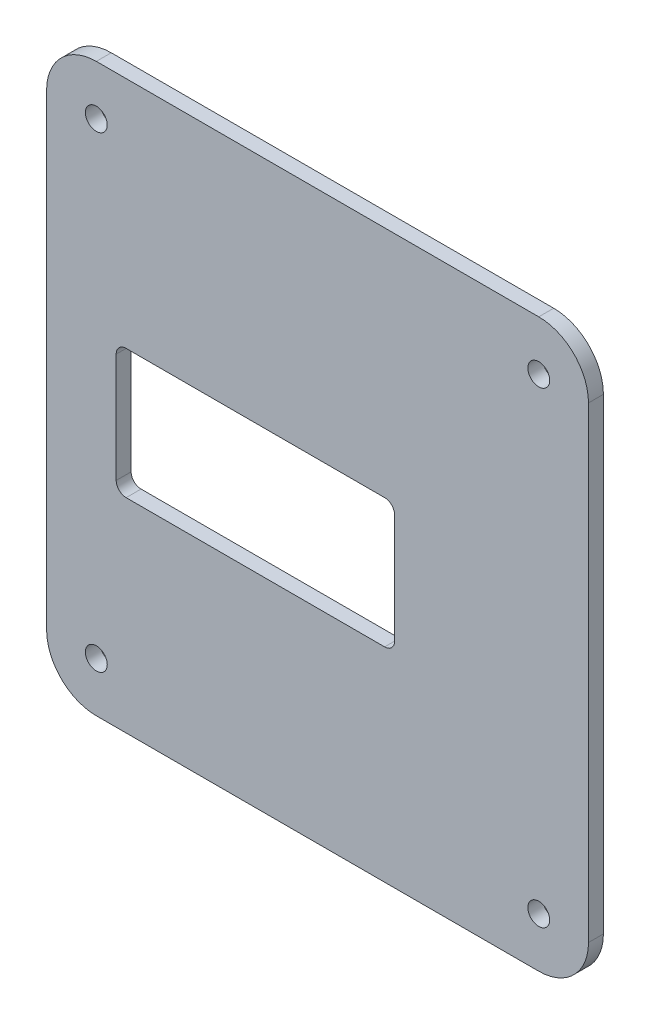
from build123d import *

# Parameters (mm, degrees)
SKETCH_1_W      = 109
SKETCH_1_H      = 114
SKETCH_1_R      = 2.2
SKETCH_1_W_2    = 56
SKETCH_1_H_2    = 26
EXTRUDE_1_DEPTH = 3
FILLET_2_R      = 2
FILLET_3_R      = 10


with BuildPart() as part:
    # 草图1 → 凸台-拉伸1 (new body)
    with BuildSketch(Plane.XY):
        with Locations((54.5, -57)):
            Rectangle(SKETCH_1_W, SKETCH_1_H)
        with Locations((99, -10)):
            Circle(SKETCH_1_R, mode=Mode.SUBTRACT)
        with Locations((99, -104)):
            Circle(SKETCH_1_R, mode=Mode.SUBTRACT)
        with Locations((10, -10)):
            Circle(SKETCH_1_R, mode=Mode.SUBTRACT)
        with Locations((10, -104)):
            Circle(SKETCH_1_R, mode=Mode.SUBTRACT)
        with Locations((42, -60)):
            Rectangle(SKETCH_1_W_2, SKETCH_1_H_2, mode=Mode.SUBTRACT)
    extrude(amount=EXTRUDE_1_DEPTH)

    # 圆角2
    fillet_2_edges = [part.edges().sort_by_distance(p)[0] for p in [
        (14, -47, 1.5),
        (14, -73, 1.5),
        (70, -73, 1.5),
        (70, -47, 1.5),
    ]]
    fillet(fillet_2_edges, radius=FILLET_2_R)

    # 圆角3
    fillet_3_edges = [part.edges().sort_by_distance(p)[0] for p in [
        (0, 0, 1.5),
        (109, 0, 1.5),
        (109, -114, 1.5),
        (0, -114, 1.5),
    ]]
    fillet(fillet_3_edges, radius=FILLET_3_R)


solid = part.part
